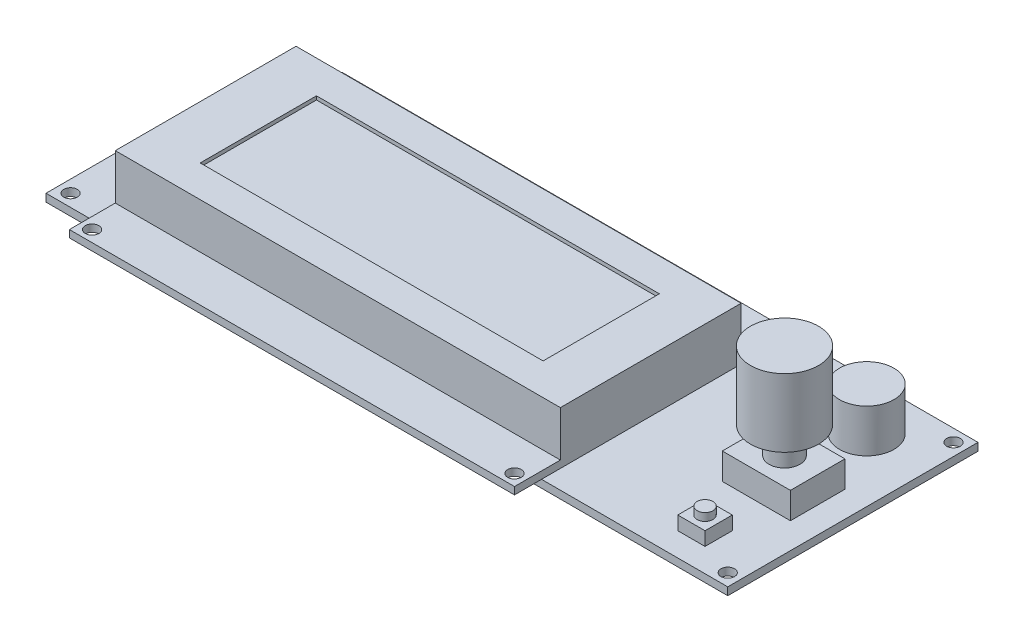
from build123d import *

# Parameters (mm, degrees)
SKETCH1_W            = 150.1
SKETCH1_H            = 55.1
SKETCH1_R            = 1.5
BOSS_EXTRUDE1_DEPTH  = 1.7
SKETCH2_W            = 40.8
SKETCH2_H            = 2.5
BOSS_EXTRUDE2_DEPTH  = 2.4
SKETCH3_W            = 98
SKETCH3_H            = 60
SKETCH3_R            = 1.5
BOSS_EXTRUDE3_DEPTH  = 1.6
SKETCH4_W            = 98
SKETCH4_H            = 39.8
BOSS_EXTRUDE4_DEPTH  = 10
SKETCH5_W            = 75.5
SKETCH5_H            = 25.6
CUT_EXTRUDE1_DEPTH   = 0.8
SKETCH6_R            = 6
BOSS_EXTRUDE5_DEPTH  = 9.5
SKETCH7_W            = 6
SKETCH7_H            = 6
BOSS_EXTRUDE6_DEPTH  = 3
SKETCH8_R            = 1.75
BOSS_EXTRUDE7_DEPTH  = 1.7
SKETCH9_W            = 26.3
SKETCH9_H            = 26.5
BOSS_EXTRUDE8_DEPTH  = 2.8
SKETCH10_W           = 20.2
SKETCH10_H           = 8.6
BOSS_EXTRUDE9_DEPTH  = 9
SKETCH11_R           = 4.65
BOSS_EXTRUDE10_DEPTH = 9
SKETCH12_W           = 15
SKETCH12_H           = 12
BOSS_EXTRUDE11_DEPTH = 5.8
SKETCH13_R           = 3.4
BOSS_EXTRUDE12_DEPTH = 5.9
SKETCH14_R           = 7.5
BOSS_EXTRUDE13_DEPTH = 15


with BuildPart() as part:
    # Sketch1 → Boss-Extrude1 (new body)
    with BuildSketch(Plane(origin=(0, 0, 0), x_dir=(1, 0, 0), z_dir=(0, 1, 0))):
        Rectangle(SKETCH1_W, SKETCH1_H)
        with Locations(Location((-72.35, 24.85, 0), (0, 0, 270))):
            Circle(SKETCH1_R, mode=Mode.SUBTRACT)
        with Locations(Location((-72.35, -24.85, 0), (0, 0, 270))):
            Circle(SKETCH1_R, mode=Mode.SUBTRACT)
        with Locations(Location((72.35, 24.85, 0), (0, 0, 270))):
            Circle(SKETCH1_R, mode=Mode.SUBTRACT)
        with Locations(Location((72.35, -24.85, 0), (0, 0, 270))):
            Circle(SKETCH1_R, mode=Mode.SUBTRACT)
    extrude(amount=BOSS_EXTRUDE1_DEPTH)

    # Sketch2 → Boss-Extrude2 (add)
    with BuildSketch(Plane(origin=(0, 1.7, 0), x_dir=(1, 0, 0), z_dir=(0, 1, 0))):
        with Locations((-32.85, 21.9)):
            Rectangle(SKETCH2_W, SKETCH2_H)
    extrude(amount=BOSS_EXTRUDE2_DEPTH)

    # Sketch3 → Boss-Extrude3 (add)
    with BuildSketch(Plane(origin=(0, 4.1, 0), x_dir=(1, 0, 0), z_dir=(0, 1, 0))):
        with Locations((-12.55, -5.9)):
            Rectangle(SKETCH3_W, SKETCH3_H)
        with Locations(Location((-59.05, 21.6, 0), (0, 0, 270))):
            Circle(SKETCH3_R, mode=Mode.SUBTRACT)
        with Locations(Location((33.95, 21.6, 0), (0, 0, 270))):
            Circle(SKETCH3_R, mode=Mode.SUBTRACT)
        with Locations(Location((33.95, -33.4, 0), (0, 0, 270))):
            Circle(SKETCH3_R, mode=Mode.SUBTRACT)
        with Locations(Location((-59.05, -33.4, 0), (0, 0, 270))):
            Circle(SKETCH3_R, mode=Mode.SUBTRACT)
    extrude(amount=BOSS_EXTRUDE3_DEPTH)

    # Sketch4 → Boss-Extrude4 (add)
    with BuildSketch(Plane(origin=(0, 5.7, 0), x_dir=(1, 0, 0), z_dir=(0, 1, 0))):
        with Locations((-12.55, -5.9)):
            Rectangle(SKETCH4_W, SKETCH4_H)
    extrude(amount=BOSS_EXTRUDE4_DEPTH)

    # Sketch5 → Cut-Extrude1 (cut)
    with BuildSketch(Plane(origin=(0, 15.7, 0), x_dir=(1, 0, 0), z_dir=(0, 1, 0))):
        with Locations((-12.1, -6)):
            Rectangle(SKETCH5_W, SKETCH5_H)
    extrude(amount=-CUT_EXTRUDE1_DEPTH, mode=Mode.SUBTRACT)

    # Sketch6 → Boss-Extrude5 (add)
    with BuildSketch(Plane(origin=(0, 1.7, 0), x_dir=(1, 0, 0), z_dir=(0, 1, 0))):
        with Locations(Location((61.15, 16.95, 0), (0, 0, 90))):
            Circle(SKETCH6_R)
    extrude(amount=BOSS_EXTRUDE5_DEPTH)

    # Sketch7 → Boss-Extrude6 (add)
    with BuildSketch(Plane(origin=(0, 1.7, 0), x_dir=(1, 0, 0), z_dir=(0, 1, 0))):
        with Locations((61.85, -19.35)):
            Rectangle(SKETCH7_W, SKETCH7_H)
    extrude(amount=BOSS_EXTRUDE6_DEPTH)

    # Sketch8 → Boss-Extrude7 (add)
    with BuildSketch(Plane(origin=(0, 4.7, 0), x_dir=(1, 0, 0), z_dir=(0, 1, 0))):
        with Locations(Location((61.85, -19.35, 0), (0, 0, 270))):
            Circle(SKETCH8_R)
    extrude(amount=BOSS_EXTRUDE7_DEPTH)

    # Sketch9 → Boss-Extrude8 (add)
    with BuildSketch(Plane.XZ):
        with Locations((-61.9, 6)):
            Rectangle(SKETCH9_W, SKETCH9_H)
    extrude(amount=BOSS_EXTRUDE8_DEPTH)

    # Sketch10 → Boss-Extrude9 (add)
    with BuildSketch(Plane.XZ):
        with Locations((3.95, -1.35)):
            Rectangle(SKETCH10_W, SKETCH10_H)
        with Locations((-19.05, -1.35)):
            Rectangle(SKETCH10_W, SKETCH10_H)
    extrude(amount=BOSS_EXTRUDE9_DEPTH)

    # Sketch11 → Boss-Extrude10 (add)
    with BuildSketch(Plane.XZ):
        with Locations(Location((-62, -16.5, 0), (0, 0, 270))):
            Circle(SKETCH11_R)
    extrude(amount=BOSS_EXTRUDE10_DEPTH)

    # Sketch12 → Boss-Extrude11 (add)
    with BuildSketch(Plane(origin=(0, 1.7, 0), x_dir=(1, 0, 0), z_dir=(0, 1, 0))):
        with Locations((61.85, -2.05)):
            Rectangle(SKETCH12_W, SKETCH12_H)
    extrude(amount=BOSS_EXTRUDE11_DEPTH)

    # Sketch13 → Boss-Extrude12 (add)
    with BuildSketch(Plane(origin=(0, 7.5, 0), x_dir=(1, 0, 0), z_dir=(0, 1, 0))):
        with Locations(Location((62.05, -2.05, 0), (0, 0, 270))):
            Circle(SKETCH13_R)
    extrude(amount=BOSS_EXTRUDE12_DEPTH)

    # Sketch14 → Boss-Extrude13 (add)
    with BuildSketch(Plane(origin=(0, 13.4, 0), x_dir=(1, 0, 0), z_dir=(0, 1, 0))):
        with Locations(Location((62.05, -2.05, 0), (0, 0, 270))):
            Circle(SKETCH14_R)
    extrude(amount=BOSS_EXTRUDE13_DEPTH)


solid = part.part
